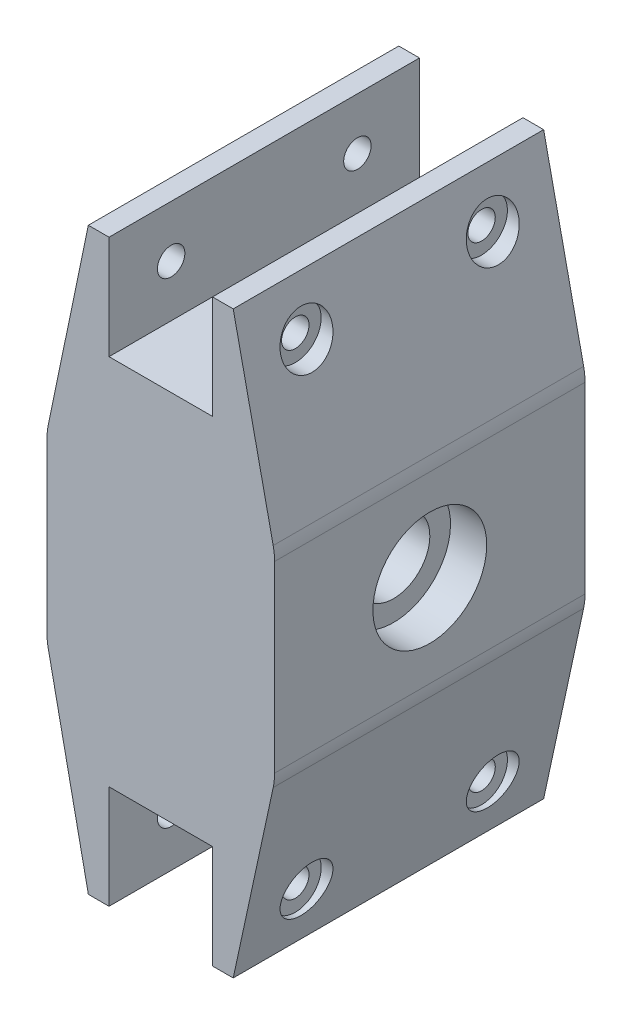
from build123d import *

# Parameters (mm, degrees)
SKETCH1_W           = 20
SKETCH1_H           = 72
BOSS_EXTRUDE1_DEPTH = 60
SKETCH2_R           = 7
CUT_EXTRUDE1_DEPTH  = 94.123573815
SKETCH3_R           = 11
CUT_EXTRUDE2_DEPTH  = 7
CUT_EXTRUDE3_START  = -7
SKETCH4_R           = 11
CUT_EXTRUDE3_DEPTH  = 7
SKETCH5_R           = 2.65
CUT_EXTRUDE4_DEPTH  = 92.301697684
SKETCH6_R           = 5
CUT_EXTRUDE5_DEPTH  = 4
FILLET1_R           = 12
CUT_EXTRUDE6_START  = 4
SKETCH7_R           = 5
CUT_EXTRUDE6_DEPTH  = 4


with BuildPart() as part:
    # Sketch1 → Boss-Extrude1 (new body)
    with BuildSketch(Plane.XY):
        Polygon((10, 36), (10, 56), (14, 56), (22, 19), (22, -19), (14, -56), (10, -56), (10, -36), align=None)
        Rectangle(SKETCH1_W, SKETCH1_H)
        Polygon((-14, -56), (-10, -56), (-10, -36), (-10, 36), (-10, 56), (-14, 56), (-22, 17.5), (-22, -17.5), align=None)
        Polygon((14, 56), (22, 19), (22, -19), (14, -56), align=None)
    extrude(amount=BOSS_EXTRUDE1_DEPTH)

    # Sketch2 → Cut-Extrude1 (cut, through all)
    with BuildSketch(Plane.ZY.offset(22)):
        with Locations((30, 0)):
            Circle(SKETCH2_R)
    extrude(amount=-CUT_EXTRUDE1_DEPTH, mode=Mode.SUBTRACT)

    # Sketch3 → Cut-Extrude2 (cut)
    with BuildSketch(Plane.ZY.offset(22)):
        with Locations((30, 0)):
            Circle(SKETCH3_R)
    extrude(amount=-CUT_EXTRUDE2_DEPTH, mode=Mode.SUBTRACT)

    # Sketch4 → Cut-Extrude3 (cut)
    with BuildSketch(Plane(origin=(22, 0, 0), x_dir=(0, 0, -1), z_dir=(1, 0, 0)).offset(CUT_EXTRUDE3_START)):
        with Locations(Location((-30, 0, 0), (0, 0, 180))):
            Circle(SKETCH4_R)
    extrude(amount=CUT_EXTRUDE3_DEPTH, mode=Mode.SUBTRACT)

    # Sketch5 → Cut-Extrude4 (cut, through all)
    with BuildSketch(Plane(origin=(-18, 0, 0), x_dir=(0, 0, -1), z_dir=(1, 0, 0))):
        with Locations(Location((-12, 46, 0), (0, 0, 180))):
            Circle(SKETCH5_R)
        with Locations(Location((-48, 46, 0), (0, 0, 180))):
            Circle(SKETCH5_R)
    cut_extrude4 = extrude(amount=CUT_EXTRUDE4_DEPTH, mode=Mode.SUBTRACT)

    # Sketch6 → Cut-Extrude5 (cut)
    with BuildSketch(Plane(origin=(-18, 0, 0), x_dir=(0, 0, -1), z_dir=(1, 0, 0))):
        with Locations(Location((-12, 46, 0), (0, 0, 270))):
            Circle(SKETCH6_R)
        with Locations(Location((-48, 46, 0), (0, 0, 270))):
            Circle(SKETCH6_R)
    cut_extrude5 = extrude(amount=CUT_EXTRUDE5_DEPTH, mode=Mode.SUBTRACT)

    # Mirror3: Cut-Extrude4, Cut-Extrude5 across plane
    add(cut_extrude4.mirror(Plane.ZX), mode=Mode.SUBTRACT)
    add(cut_extrude5.mirror(Plane.ZX), mode=Mode.SUBTRACT)

    # Fillet1
    fillet1_edges = [part.edges().sort_by_distance(p)[0] for p in [
        (-22, -17.5, 30),
        (-22, 17.5, 30),
        (22, 19, 30),
        (22, -19, 30),
    ]]
    fillet(fillet1_edges, radius=FILLET1_R)

    # Sketch7 → Cut-Extrude6 (cut)
    with BuildSketch(Plane.ZY.offset(-18).offset(CUT_EXTRUDE6_START)):
        with Locations(Location((12, 46, 0), (0, 0, 270))):
            Circle(SKETCH7_R)
        with Locations(Location((48, 46, 0), (0, 0, 270))):
            Circle(SKETCH7_R)
    cut_extrude6 = extrude(amount=-CUT_EXTRUDE6_DEPTH, mode=Mode.SUBTRACT)

    # Mirror5: Cut-Extrude6 across plane
    add(cut_extrude6.mirror(Plane.ZX), mode=Mode.SUBTRACT)


solid = part.part
